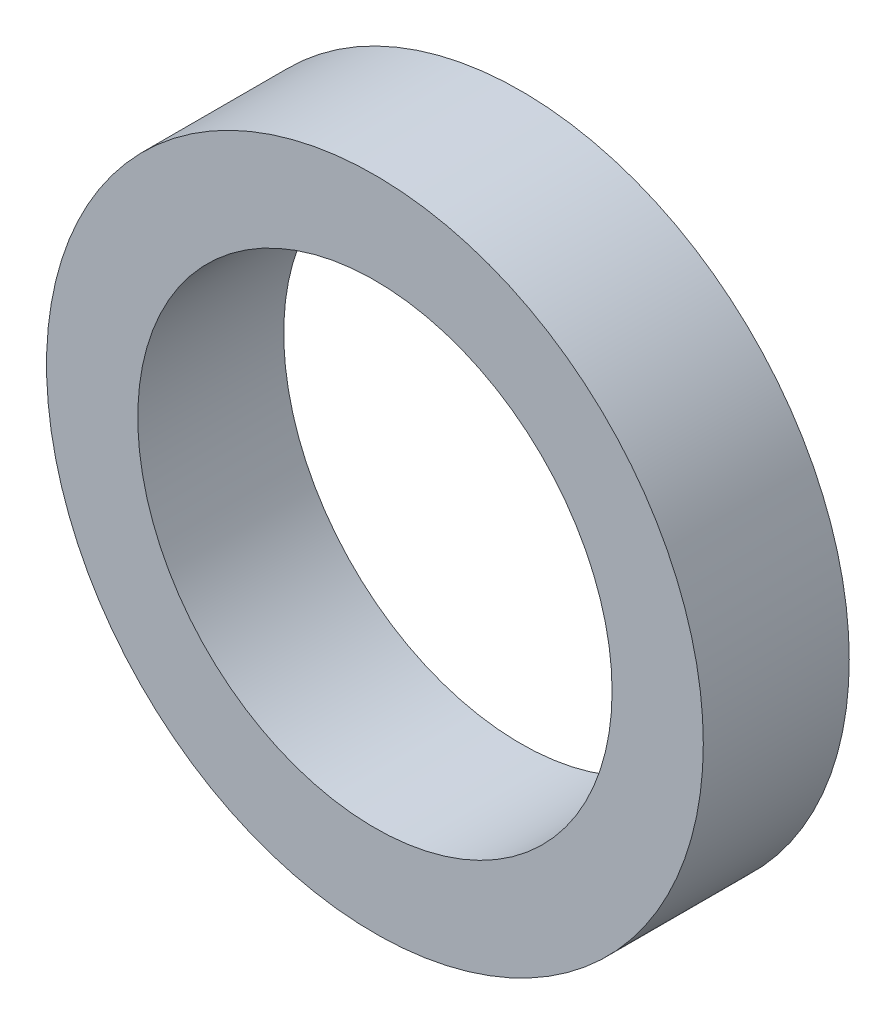
from build123d import *

# Parameters (mm, degrees)
SKETCH_1_R      = 4.5
SKETCH_1_R_2    = 3.25
EXTRUDE_1_DEPTH = 2


with BuildPart() as part:
    # ｽｹｯﾁ1 → ﾎﾞｽ - 押し出し1 (new body)
    with BuildSketch(Plane.XY):
        Circle(SKETCH_1_R)
        Circle(SKETCH_1_R_2, mode=Mode.SUBTRACT)
    extrude(amount=EXTRUDE_1_DEPTH)


solid = part.part
